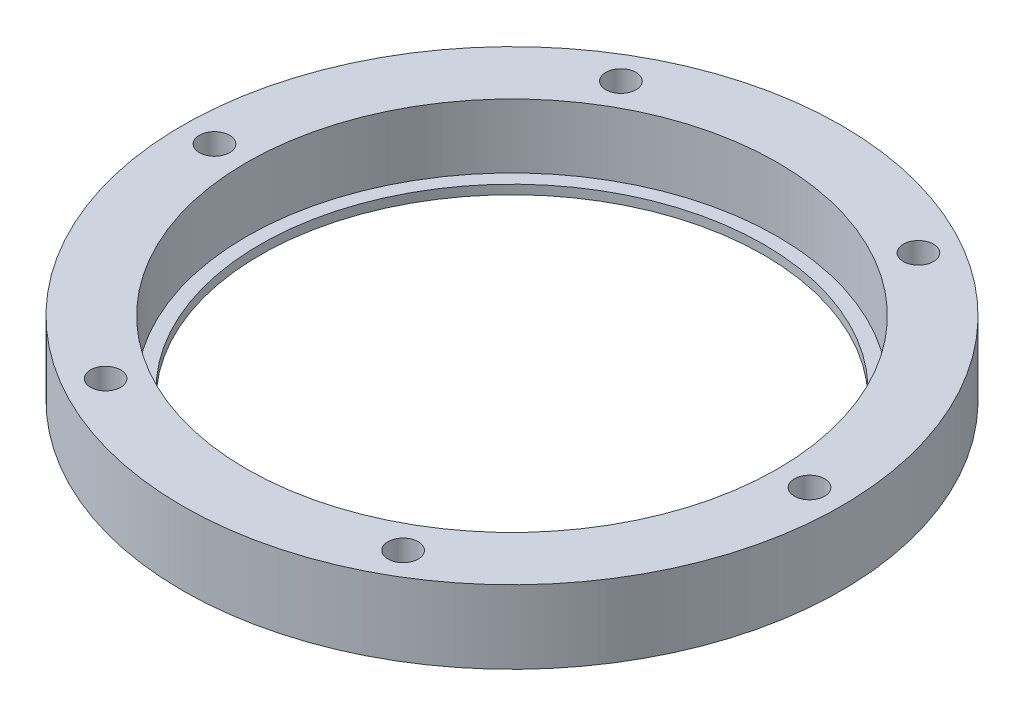
from build123d import *

# Parameters (mm, degrees)
SKETCH_2_R         = 36
SKETCH_2_R_2       = 29
EXTRUDE_1_DEPTH    = 7
EXTRUDE_START      = 1
SKETCH_3_R         = 36
SKETCH_3_R_2       = 27.5
EXTRUDE_2_DEPTH    = 1
HOLE_WIZARD_M4_1_D = 3.3


with BuildPart() as part:
    # 草图2 → 凸台-拉伸1 (new body)
    with BuildSketch(Plane(origin=(0, 0, 0), x_dir=(1, 0, 0), z_dir=(0, 1, 0))):
        with Locations(Location((0, 0, 0), (0, 0, 270))):
            Circle(SKETCH_2_R)
        with Locations(Location((0, 0, 0), (0, 0, 270))):
            Circle(SKETCH_2_R_2, mode=Mode.SUBTRACT)
    extrude(amount=EXTRUDE_1_DEPTH)

    # 草图3 → 凸台-拉伸2 (add)
    with BuildSketch(Plane.XZ.offset(EXTRUDE_START)):
        with Locations(Location((0, 0, 0), (0, 0, 270))):
            Circle(SKETCH_3_R)
        with Locations(Location((0, 0, 0), (0, 0, 270))):
            Circle(SKETCH_3_R_2, mode=Mode.SUBTRACT)
    extrude(amount=-EXTRUDE_2_DEPTH)

    # M4 螺纹孔1 (through all)
    with Locations(Plane(origin=(0, 7, 0), x_dir=(1, 0, 0), z_dir=(0, 1, 0))):
        with Locations((-16.25, 28.145825623), (16.25, 28.145825623), (32.5, 0), (16.25, -28.145825623), (-16.25, -28.145825623), (-32.5, 0)):
            Hole(HOLE_WIZARD_M4_1_D / 2)


solid = part.part
